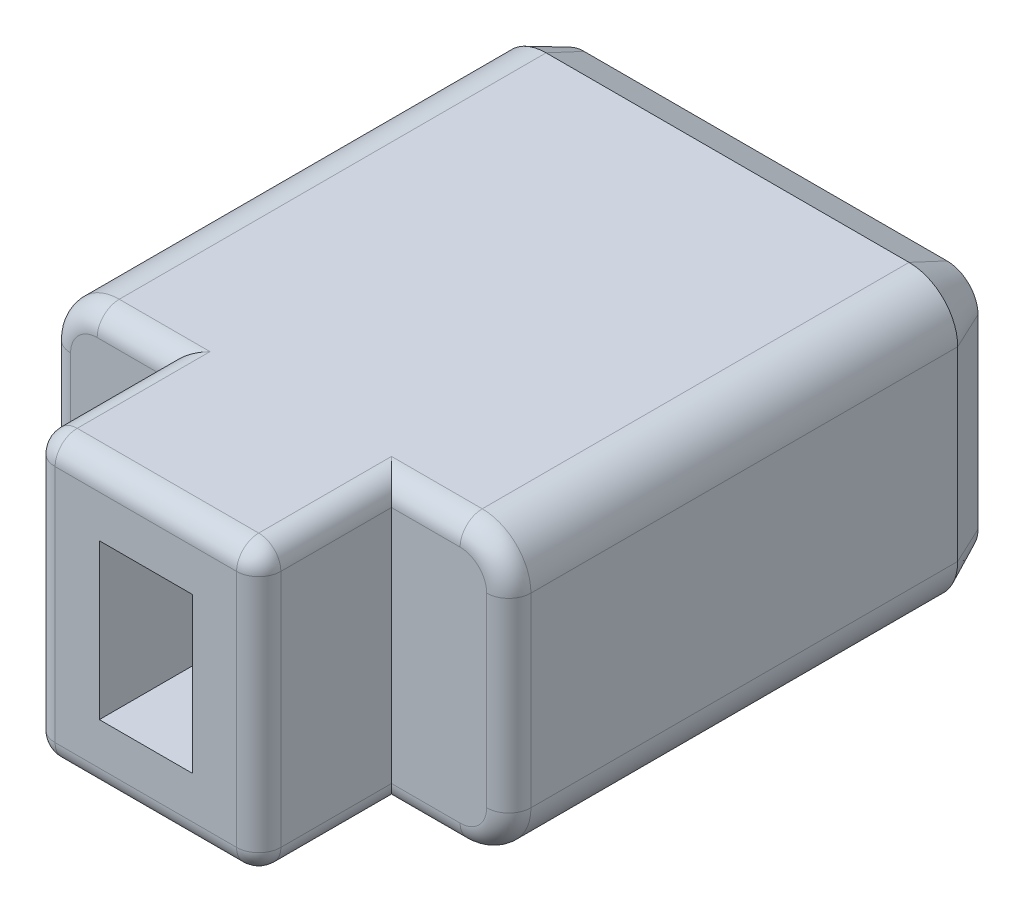
from build123d import *

# Parameters (mm, degrees)
BOSS_EXTRU_1_DEPTH      = 14
ESQUISSE3_W             = 2.1
ESQUISSE3_H             = 3.5
ENL_V_MAT_EXTRU_1_DEPTH = 3
ESQUISSE4_OUTSIDE_W     = 16.116
ESQUISSE4_OUTSIDE_H     = 12.116
ESQUISSE4_OUTSIDE_W_2   = 5.1
ESQUISSE4_OUTSIDE_H_2   = 6.4
ENL_V_MAT_EXTRU_2_DEPTH = 3
CONG_1_R                = 0.5
CHANFREIN1_SIZE         = 0.4
CHANFREIN1_SIZE2        = 0.857802768
ENL_V_MAT_EXTRU_3_DEPTH = 0.3
BOSS_EXTRU_2_DEPTH      = 0.3


with BuildPart() as part:
    # Esquisse2 → Boss.-Extru.1 (new body)
    with BuildSketch(Plane.XY):
        with BuildLine():
            Line((1.1, 0), (9.3, 0))
            ThreePointArc((9.3, 0), (10.077817459, 0.322182541), (10.4, 1.1))
            Line((10.4, 1.1), (10.4, 5.3))
            ThreePointArc((10.4, 5.3), (10.077817459, 6.077817459), (9.3, 6.4))
            Line((9.3, 6.4), (1.1, 6.4))
            ThreePointArc((1.1, 6.4), (0.322182541, 6.077817459), (0, 5.3))
            Line((0, 5.3), (0, 1.1))
            ThreePointArc((0, 1.1), (0.322182541, 0.322182541), (1.1, 0))
        make_face()
    extrude(amount=BOSS_EXTRU_1_DEPTH)

    # Esquisse3 → Enlèv. mat.-Extru.1 (cut)
    with BuildSketch(Plane.XY.offset(14)):
        with Locations((5.2, 3.2)):
            Rectangle(ESQUISSE3_W, ESQUISSE3_H)
    extrude(amount=-ENL_V_MAT_EXTRU_1_DEPTH, mode=Mode.SUBTRACT)

    # Esquisse4 outside → Enlèv. mat.-Extru.2 (cut)
    with BuildSketch(Plane.XY.offset(14)):
        with Locations((5.2, 3.2)):
            Rectangle(ESQUISSE4_OUTSIDE_W, ESQUISSE4_OUTSIDE_H)
        with Locations((5.2, 3.2)):
            Rectangle(ESQUISSE4_OUTSIDE_W_2, ESQUISSE4_OUTSIDE_H_2, mode=Mode.SUBTRACT)
    extrude(amount=-ENL_V_MAT_EXTRU_2_DEPTH, mode=Mode.SUBTRACT)

    # Congé1
    cong_1_edges = [part.edges().sort_by_distance(p)[0] for p in [
        (8.525, 0, 11),
        (10.077817459, 0.322182541, 11),
        (10.4, 3.2, 11),
        (10.077817459, 6.077817459, 11),
        (1.875, 6.4, 11),
        (0.322182541, 6.077817459, 11),
        (1.875, 0, 11),
        (0.322182541, 0.322182541, 11),
        (7.75, 6.4, 12.5),
        (2.65, 6.4, 12.5),
        (7.75, 0, 12.5),
        (2.65, 0, 12.5),
        (2.65, 3.2, 14),
        (5.2, 6.4, 14),
        (7.75, 3.2, 14),
        (5.2, 0, 14),
        (8.525, 6.4, 11),
        (0, 3.2, 11),
    ]]
    fillet(cong_1_edges, radius=CONG_1_R)

    # Chanfrein1
    chanfrein1_edges = [part.edges().sort_by_distance(p)[0] for p in [
        (5.2, 0, 0),
        (10.077817459, 0.322182541, 0),
        (0.322182541, 0.322182541, 0),
        (10.4, 3.2, 0),
        (0, 3.2, 0),
        (10.077817459, 6.077817459, 0),
        (0.322182541, 6.077817459, 0),
        (5.2, 6.4, 0),
    ]]
    chanfrein1_side = [part.faces().sort_by_distance(p)[0] for p in [
        (5.2, 3.2, 0),
    ]]
    chamfer(chanfrein1_edges, length=CHANFREIN1_SIZE, length2=CHANFREIN1_SIZE2, reference=chanfrein1_side[0])

    # Esquisse5 → Enlèv. mat.-Extru.3 (cut)
    with BuildSketch(Plane(origin=(0, 0, 0), x_dir=(-1, 0, 0), z_dir=(0, 0, -1))):
        with BuildLine():
            Line((-5.61025641, 1.197435897), (-5.905929487, 1.42900641))
            Line((-5.905929487, 1.42900641), (-4.983653846, 3.041185897))
            add(Edge.make_bspline(
                [(-4.983653846, 3.041185897), (-5.014818835, 3.033573937), (-5.075724224, 3.018697967), (-5.16649261, 3.003606868), (-5.254031024, 2.994460036), (-5.311357697, 2.993015092), (-5.339423077, 2.992307692)],
                knots=[0, 0, 0, 0, 1.069017442, 2.089168874, 3.064515738, 4, 4, 4, 4], degree=3))
            add(Edge.make_bspline(
                [(-5.339423077, 2.992307692), (-5.373140867, 2.993423536), (-5.439890887, 2.995632537), (-5.537749929, 3.012049254), (-5.631973031, 3.038534865), (-5.721932526, 3.076557411), (-5.808189439, 3.124953148), (-5.890585673, 3.184165695), (-5.969045058, 3.253925599), (-6.042217241, 3.333938364), (-6.109038627, 3.421339006), (-6.1676878, 3.514702352), (-6.218086342, 3.612834773), (-6.257376136, 3.716653867), (-6.290296552, 3.824566528), (-6.312381402, 3.937866744), (-6.325142567, 4.056115466), (-6.327172474, 4.136507023), (-6.328205128, 4.177403846)],
                knots=[0, 0, 0, 0, 0.942553966, 1.865943652, 2.766733261, 3.673940853, 4.590204225, 5.527059003, 6.505849152, 7.52076352, 8.554521604, 9.578220193, 10.600364479, 11.633717745, 12.678213115, 13.751916221, 14.856353979, 16, 16, 16, 16], degree=3))
            add(Edge.make_bspline(
                [(-6.328205128, 4.177403846), (-6.326603403, 4.233341954), (-6.323457899, 4.343194447), (-6.29599668, 4.503355096), (-6.253231723, 4.655751293), (-6.190912682, 4.798322672), (-6.114077348, 4.93060133), (-6.020595441, 5.048834763), (-5.913266673, 5.15342069), (-5.791836733, 5.241617679), (-5.660942196, 5.31293055), (-5.523338908, 5.365037204), (-5.380361692, 5.396398228), (-5.283218086, 5.400503426), (-5.234455128, 5.402564103)],
                knots=[0, 0, 0, 0, 1.100056568, 2.160315386, 3.188427629, 4.207809803, 5.213838152, 6.190705293, 7.164584177, 8.153872716, 9.134634922, 10.08940477, 11.040942793, 12, 12, 12, 12], degree=3))
            add(Edge.make_bspline(
                [(-5.234455128, 5.402564103), (-5.187289577, 5.400804731), (-5.093607835, 5.397310209), (-4.95608243, 5.36644897), (-4.823950155, 5.31613533), (-4.698529119, 5.246430495), (-4.5824853, 5.158943023), (-4.477303826, 5.055483755), (-4.387894828, 4.933817109), (-4.311569467, 4.798943106), (-4.249896696, 4.654164091), (-4.206905649, 4.501980935), (-4.17924905, 4.345077735), (-4.175998579, 4.23841716), (-4.174358974, 4.184615385)],
                knots=[0, 0, 0, 0, 0.944514783, 1.876025815, 2.809749976, 3.770782873, 4.742022766, 5.715017251, 6.717312799, 7.757958031, 8.816032333, 9.86330905, 10.922209375, 12, 12, 12, 12], degree=3))
            add(Edge.make_bspline(
                [(-4.174358974, 4.184615385), (-4.175539059, 4.1434346), (-4.177945878, 4.059445151), (-4.194748365, 3.932211398), (-4.22117984, 3.801729548), (-4.259746448, 3.666466508), (-4.312008113, 3.523003895), (-4.380147376, 3.367633901), (-4.465304201, 3.198803446), (-4.530930712, 3.08336275), (-4.565384615, 3.02275641)],
                knots=[0, 0, 0, 0, 0.796645725, 1.62478291, 2.479141068, 3.370698376, 4.343336413, 5.431070381, 6.651312523, 8, 8, 8, 8], degree=3))
            Line((-4.565384615, 3.02275641), (-5.61025641, 1.197435897))
        make_face()
        with BuildLine():
            add(Edge.make_bspline(
                [(-5.250480769, 3.402564103), (-5.22614592, 3.403467511), (-5.178058902, 3.405252698), (-5.107226303, 3.415410165), (-5.039333151, 3.434231439), (-4.974463413, 3.459999012), (-4.911795821, 3.492179907), (-4.852533717, 3.53277955), (-4.795445049, 3.580046319), (-4.742383794, 3.634308875), (-4.693533137, 3.693503216), (-4.650317007, 3.756366242), (-4.614060539, 3.822762408), (-4.583963734, 3.891800104), (-4.562007602, 3.964582469), (-4.544766662, 4.039708835), (-4.535124033, 4.118392084), (-4.533938812, 4.171769977), (-4.533333333, 4.199038462)],
                knots=[0, 0, 0, 0, 0.980450227, 1.937424298, 2.874354807, 3.811285315, 4.74475074, 5.705526773, 6.698643629, 7.725619579, 8.757317799, 9.78677002, 10.793026747, 11.800203164, 12.81419361, 13.850369222, 14.901845495, 16, 16, 16, 16], degree=3))
            add(Edge.make_bspline(
                [(-4.533333333, 4.199038462), (-4.533945723, 4.226040817), (-4.535150268, 4.27915335), (-4.544762963, 4.357291393), (-4.56173668, 4.432076406), (-4.585170129, 4.503921184), (-4.614748087, 4.572958359), (-4.651060295, 4.638900636), (-4.69362065, 4.701985458), (-4.743259874, 4.760286778), (-4.796207673, 4.81484218), (-4.853304698, 4.862169047), (-4.912850799, 4.902453612), (-4.974844876, 4.936065638), (-5.040357398, 4.960354501), (-5.107992206, 4.979546841), (-5.178869362, 4.989596991), (-5.226950286, 4.991396855), (-5.251282051, 4.992307692)],
                knots=[0, 0, 0, 0, 1.089802191, 2.143596548, 3.171536916, 4.180760996, 5.190157834, 6.198632954, 7.21537346, 8.256237336, 9.285477357, 10.280783638, 11.243677797, 12.184220045, 13.119308391, 14.058304456, 15.017388272, 16, 16, 16, 16], degree=3))
            add(Edge.make_bspline(
                [(-5.251282051, 4.992307692), (-5.275614239, 4.991397667), (-5.323695999, 4.989599407), (-5.394567048, 4.979537527), (-5.462224448, 4.96038858), (-5.527874618, 4.935855802), (-5.590376339, 4.902699616), (-5.650058395, 4.862148422), (-5.70710423, 4.814804415), (-5.76021125, 4.760588944), (-5.80878233, 4.701456026), (-5.852400301, 4.639172859), (-5.888755551, 4.573111942), (-5.917197304, 4.503729433), (-5.940890098, 4.432101693), (-5.957783843, 4.357284414), (-5.967418378, 4.279155183), (-5.968619911, 4.226041435), (-5.969230769, 4.199038462)],
                knots=[0, 0, 0, 0, 0.982333901, 1.941146542, 2.879877112, 3.814701068, 4.764504859, 5.727126766, 6.722151631, 7.751100641, 8.784780994, 9.807330688, 10.815520668, 11.820421087, 12.829359816, 13.85700954, 14.910505944, 16, 16, 16, 16], degree=3))
            add(Edge.make_bspline(
                [(-5.969230769, 4.199038462), (-5.968633558, 4.171767178), (-5.967464521, 4.118383805), (-5.957705027, 4.039740124), (-5.940877234, 3.964389102), (-5.917348839, 3.892163474), (-5.888775088, 3.822541836), (-5.852159038, 3.756401041), (-5.809053135, 3.693496325), (-5.760180782, 3.634301217), (-5.707095489, 3.580083112), (-5.649948669, 3.532504726), (-5.590074281, 3.492413923), (-5.527319086, 3.459979902), (-5.462200532, 3.434081118), (-5.393970011, 3.415529295), (-5.322908067, 3.405231406), (-5.274817443, 3.403460357), (-5.250480769, 3.402564103)],
                knots=[0, 0, 0, 0, 1.096895977, 2.147167217, 3.182155332, 4.198227678, 5.200051705, 6.205155221, 7.233427651, 8.263943504, 9.2897425, 10.281721205, 11.250318538, 12.182714176, 13.118570925, 14.064796065, 15.020673407, 16, 16, 16, 16], degree=3))
        make_face(mode=Mode.SUBTRACT)
    extrude(amount=-ENL_V_MAT_EXTRU_3_DEPTH, mode=Mode.SUBTRACT)


with BuildPart() as body_2:
    # Esquisse5<2> → Boss.-Extru.2 (new body)
    with BuildSketch(Plane(origin=(0, 0, 0), x_dir=(-1, 0, 0), z_dir=(0, 0, -1))):
        with BuildLine():
            Line((-5.61025641, 1.197435897), (-5.905929487, 1.42900641))
            Line((-5.905929487, 1.42900641), (-4.983653846, 3.041185897))
            add(Edge.make_bspline(
                [(-4.983653846, 3.041185897), (-5.014818835, 3.033573937), (-5.075724224, 3.018697967), (-5.16649261, 3.003606868), (-5.254031024, 2.994460036), (-5.311357697, 2.993015092), (-5.339423077, 2.992307692)],
                knots=[0, 0, 0, 0, 1.069017442, 2.089168874, 3.064515738, 4, 4, 4, 4], degree=3))
            add(Edge.make_bspline(
                [(-5.339423077, 2.992307692), (-5.373140867, 2.993423536), (-5.439890887, 2.995632537), (-5.537749929, 3.012049254), (-5.631973031, 3.038534865), (-5.721932526, 3.076557411), (-5.808189439, 3.124953148), (-5.890585673, 3.184165695), (-5.969045058, 3.253925599), (-6.042217241, 3.333938364), (-6.109038627, 3.421339006), (-6.1676878, 3.514702352), (-6.218086342, 3.612834773), (-6.257376136, 3.716653867), (-6.290296552, 3.824566528), (-6.312381402, 3.937866744), (-6.325142567, 4.056115466), (-6.327172474, 4.136507023), (-6.328205128, 4.177403846)],
                knots=[0, 0, 0, 0, 0.942553966, 1.865943652, 2.766733261, 3.673940853, 4.590204225, 5.527059003, 6.505849152, 7.52076352, 8.554521604, 9.578220193, 10.600364479, 11.633717745, 12.678213115, 13.751916221, 14.856353979, 16, 16, 16, 16], degree=3))
            add(Edge.make_bspline(
                [(-6.328205128, 4.177403846), (-6.326603403, 4.233341954), (-6.323457899, 4.343194447), (-6.29599668, 4.503355096), (-6.253231723, 4.655751293), (-6.190912682, 4.798322672), (-6.114077348, 4.93060133), (-6.020595441, 5.048834763), (-5.913266673, 5.15342069), (-5.791836733, 5.241617679), (-5.660942196, 5.31293055), (-5.523338908, 5.365037204), (-5.380361692, 5.396398228), (-5.283218086, 5.400503426), (-5.234455128, 5.402564103)],
                knots=[0, 0, 0, 0, 1.100056568, 2.160315386, 3.188427629, 4.207809803, 5.213838152, 6.190705293, 7.164584177, 8.153872716, 9.134634922, 10.08940477, 11.040942793, 12, 12, 12, 12], degree=3))
            add(Edge.make_bspline(
                [(-5.234455128, 5.402564103), (-5.187289577, 5.400804731), (-5.093607835, 5.397310209), (-4.95608243, 5.36644897), (-4.823950155, 5.31613533), (-4.698529119, 5.246430495), (-4.5824853, 5.158943023), (-4.477303826, 5.055483755), (-4.387894828, 4.933817109), (-4.311569467, 4.798943106), (-4.249896696, 4.654164091), (-4.206905649, 4.501980935), (-4.17924905, 4.345077735), (-4.175998579, 4.23841716), (-4.174358974, 4.184615385)],
                knots=[0, 0, 0, 0, 0.944514783, 1.876025815, 2.809749976, 3.770782873, 4.742022766, 5.715017251, 6.717312799, 7.757958031, 8.816032333, 9.86330905, 10.922209375, 12, 12, 12, 12], degree=3))
            add(Edge.make_bspline(
                [(-4.174358974, 4.184615385), (-4.175539059, 4.1434346), (-4.177945878, 4.059445151), (-4.194748365, 3.932211398), (-4.22117984, 3.801729548), (-4.259746448, 3.666466508), (-4.312008113, 3.523003895), (-4.380147376, 3.367633901), (-4.465304201, 3.198803446), (-4.530930712, 3.08336275), (-4.565384615, 3.02275641)],
                knots=[0, 0, 0, 0, 0.796645725, 1.62478291, 2.479141068, 3.370698376, 4.343336413, 5.431070381, 6.651312523, 8, 8, 8, 8], degree=3))
            Line((-4.565384615, 3.02275641), (-5.61025641, 1.197435897))
        make_face()
        with BuildLine():
            add(Edge.make_bspline(
                [(-5.250480769, 3.402564103), (-5.22614592, 3.403467511), (-5.178058902, 3.405252698), (-5.107226303, 3.415410165), (-5.039333151, 3.434231439), (-4.974463413, 3.459999012), (-4.911795821, 3.492179907), (-4.852533717, 3.53277955), (-4.795445049, 3.580046319), (-4.742383794, 3.634308875), (-4.693533137, 3.693503216), (-4.650317007, 3.756366242), (-4.614060539, 3.822762408), (-4.583963734, 3.891800104), (-4.562007602, 3.964582469), (-4.544766662, 4.039708835), (-4.535124033, 4.118392084), (-4.533938812, 4.171769977), (-4.533333333, 4.199038462)],
                knots=[0, 0, 0, 0, 0.980450227, 1.937424298, 2.874354807, 3.811285315, 4.74475074, 5.705526773, 6.698643629, 7.725619579, 8.757317799, 9.78677002, 10.793026747, 11.800203164, 12.81419361, 13.850369222, 14.901845495, 16, 16, 16, 16], degree=3))
            add(Edge.make_bspline(
                [(-4.533333333, 4.199038462), (-4.533945723, 4.226040817), (-4.535150268, 4.27915335), (-4.544762963, 4.357291393), (-4.56173668, 4.432076406), (-4.585170129, 4.503921184), (-4.614748087, 4.572958359), (-4.651060295, 4.638900636), (-4.69362065, 4.701985458), (-4.743259874, 4.760286778), (-4.796207673, 4.81484218), (-4.853304698, 4.862169047), (-4.912850799, 4.902453612), (-4.974844876, 4.936065638), (-5.040357398, 4.960354501), (-5.107992206, 4.979546841), (-5.178869362, 4.989596991), (-5.226950286, 4.991396855), (-5.251282051, 4.992307692)],
                knots=[0, 0, 0, 0, 1.089802191, 2.143596548, 3.171536916, 4.180760996, 5.190157834, 6.198632954, 7.21537346, 8.256237336, 9.285477357, 10.280783638, 11.243677797, 12.184220045, 13.119308391, 14.058304456, 15.017388272, 16, 16, 16, 16], degree=3))
            add(Edge.make_bspline(
                [(-5.251282051, 4.992307692), (-5.275614239, 4.991397667), (-5.323695999, 4.989599407), (-5.394567048, 4.979537527), (-5.462224448, 4.96038858), (-5.527874618, 4.935855802), (-5.590376339, 4.902699616), (-5.650058395, 4.862148422), (-5.70710423, 4.814804415), (-5.76021125, 4.760588944), (-5.80878233, 4.701456026), (-5.852400301, 4.639172859), (-5.888755551, 4.573111942), (-5.917197304, 4.503729433), (-5.940890098, 4.432101693), (-5.957783843, 4.357284414), (-5.967418378, 4.279155183), (-5.968619911, 4.226041435), (-5.969230769, 4.199038462)],
                knots=[0, 0, 0, 0, 0.982333901, 1.941146542, 2.879877112, 3.814701068, 4.764504859, 5.727126766, 6.722151631, 7.751100641, 8.784780994, 9.807330688, 10.815520668, 11.820421087, 12.829359816, 13.85700954, 14.910505944, 16, 16, 16, 16], degree=3))
            add(Edge.make_bspline(
                [(-5.969230769, 4.199038462), (-5.968633558, 4.171767178), (-5.967464521, 4.118383805), (-5.957705027, 4.039740124), (-5.940877234, 3.964389102), (-5.917348839, 3.892163474), (-5.888775088, 3.822541836), (-5.852159038, 3.756401041), (-5.809053135, 3.693496325), (-5.760180782, 3.634301217), (-5.707095489, 3.580083112), (-5.649948669, 3.532504726), (-5.590074281, 3.492413923), (-5.527319086, 3.459979902), (-5.462200532, 3.434081118), (-5.393970011, 3.415529295), (-5.322908067, 3.405231406), (-5.274817443, 3.403460357), (-5.250480769, 3.402564103)],
                knots=[0, 0, 0, 0, 1.096895977, 2.147167217, 3.182155332, 4.198227678, 5.200051705, 6.205155221, 7.233427651, 8.263943504, 9.2897425, 10.281721205, 11.250318538, 12.182714176, 13.118570925, 14.064796065, 15.020673407, 16, 16, 16, 16], degree=3))
        make_face(mode=Mode.SUBTRACT)
    extrude(amount=BOSS_EXTRU_2_DEPTH)


solid = Compound([part.part, body_2.part])
